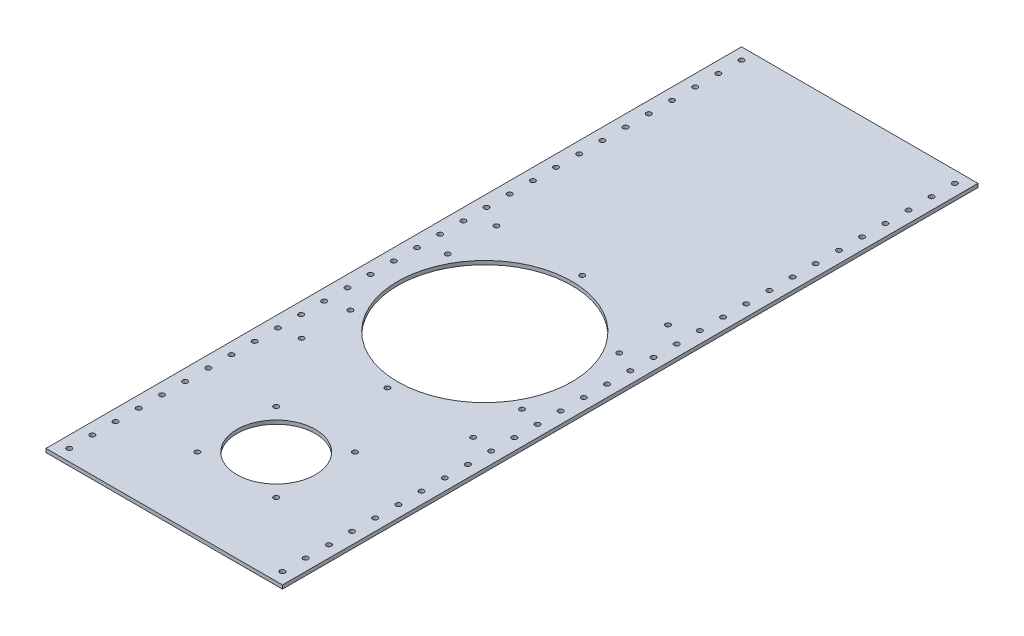
from build123d import *

# Parameters (mm, degrees)
SKETCH1_W           = 204
SKETCH1_H           = 600
SKETCH1_R           = 2.15
SKETCH1_R_2         = 2.125
SKETCH1_R_3         = 33.85
SKETCH1_R_4         = 75.125
BOSS_EXTRUDE1_DEPTH = 3.175


with BuildPart() as part:
    # Sketch1 → Boss-Extrude1 (new body)
    with BuildSketch(Plane(origin=(0, 0, 0), x_dir=(1, 0, 0), z_dir=(0, 1, 0))):
        with Locations((0, -50)):
            Rectangle(SKETCH1_W, SKETCH1_H)
        with Locations(Location((92, 240, 0), (0, 0, 270))):
            Circle(SKETCH1_R, mode=Mode.SUBTRACT)
        with Locations(Location((92, 220, 0), (0, 0, 270))):
            Circle(SKETCH1_R, mode=Mode.SUBTRACT)
        with Locations(Location((92, 200, 0), (0, 0, 270))):
            Circle(SKETCH1_R, mode=Mode.SUBTRACT)
        with Locations(Location((92, 180, 0), (0, 0, 270))):
            Circle(SKETCH1_R, mode=Mode.SUBTRACT)
        with Locations(Location((92, 160, 0), (0, 0, 270))):
            Circle(SKETCH1_R, mode=Mode.SUBTRACT)
        with Locations(Location((92, 140, 0), (0, 0, 270))):
            Circle(SKETCH1_R, mode=Mode.SUBTRACT)
        with Locations(Location((92, 120, 0), (0, 0, 270))):
            Circle(SKETCH1_R, mode=Mode.SUBTRACT)
        with Locations(Location((92, 100, 0), (0, 0, 270))):
            Circle(SKETCH1_R, mode=Mode.SUBTRACT)
        with Locations(Location((92, 80, 0), (0, 0, 270))):
            Circle(SKETCH1_R, mode=Mode.SUBTRACT)
        with Locations(Location((92, 60, 0), (0, 0, 270))):
            Circle(SKETCH1_R, mode=Mode.SUBTRACT)
        with Locations(Location((92, 40, 0), (0, 0, 270))):
            Circle(SKETCH1_R, mode=Mode.SUBTRACT)
        with Locations(Location((92, 20, 0), (0, 0, 270))):
            Circle(SKETCH1_R, mode=Mode.SUBTRACT)
        with Locations(Location((92, 0, 0), (0, 0, 270))):
            Circle(SKETCH1_R, mode=Mode.SUBTRACT)
        with Locations(Location((92, -20, 0), (0, 0, 270))):
            Circle(SKETCH1_R, mode=Mode.SUBTRACT)
        with Locations(Location((92, -40, 0), (0, 0, 270))):
            Circle(SKETCH1_R, mode=Mode.SUBTRACT)
        with Locations(Location((92, -60, 0), (0, 0, 270))):
            Circle(SKETCH1_R, mode=Mode.SUBTRACT)
        with Locations(Location((92, -80, 0), (0, 0, 270))):
            Circle(SKETCH1_R, mode=Mode.SUBTRACT)
        with Locations(Location((92, -100, 0), (0, 0, 270))):
            Circle(SKETCH1_R, mode=Mode.SUBTRACT)
        with Locations(Location((92, -120, 0), (0, 0, 270))):
            Circle(SKETCH1_R, mode=Mode.SUBTRACT)
        with Locations(Location((92, -140, 0), (0, 0, 270))):
            Circle(SKETCH1_R, mode=Mode.SUBTRACT)
        with Locations(Location((92, -160, 0), (0, 0, 270))):
            Circle(SKETCH1_R, mode=Mode.SUBTRACT)
        with Locations(Location((92, -180, 0), (0, 0, 270))):
            Circle(SKETCH1_R, mode=Mode.SUBTRACT)
        with Locations(Location((92, -200, 0), (0, 0, 270))):
            Circle(SKETCH1_R, mode=Mode.SUBTRACT)
        with Locations(Location((92, -220, 0), (0, 0, 270))):
            Circle(SKETCH1_R, mode=Mode.SUBTRACT)
        with Locations(Location((92, -240, 0), (0, 0, 270))):
            Circle(SKETCH1_R, mode=Mode.SUBTRACT)
        with Locations(Location((92, -260, 0), (0, 0, 270))):
            Circle(SKETCH1_R, mode=Mode.SUBTRACT)
        with Locations(Location((92, -280, 0), (0, 0, 270))):
            Circle(SKETCH1_R, mode=Mode.SUBTRACT)
        with Locations(Location((92, -300, 0), (0, 0, 270))):
            Circle(SKETCH1_R, mode=Mode.SUBTRACT)
        with Locations(Location((92, -320, 0), (0, 0, 270))):
            Circle(SKETCH1_R, mode=Mode.SUBTRACT)
        with Locations(Location((92, -340, 0), (0, 0, 270))):
            Circle(SKETCH1_R, mode=Mode.SUBTRACT)
        with Locations(Location((-92, -340, 0), (0, 0, 90))):
            Circle(SKETCH1_R, mode=Mode.SUBTRACT)
        with Locations(Location((-92, -320, 0), (0, 0, 90))):
            Circle(SKETCH1_R, mode=Mode.SUBTRACT)
        with Locations(Location((-92, -300, 0), (0, 0, 90))):
            Circle(SKETCH1_R, mode=Mode.SUBTRACT)
        with Locations(Location((-92, -280, 0), (0, 0, 90))):
            Circle(SKETCH1_R, mode=Mode.SUBTRACT)
        with Locations(Location((-92, -260, 0), (0, 0, 90))):
            Circle(SKETCH1_R, mode=Mode.SUBTRACT)
        with Locations(Location((-92, -240, 0), (0, 0, 90))):
            Circle(SKETCH1_R, mode=Mode.SUBTRACT)
        with Locations(Location((-92, -220, 0), (0, 0, 90))):
            Circle(SKETCH1_R, mode=Mode.SUBTRACT)
        with Locations(Location((-92, -200, 0), (0, 0, 90))):
            Circle(SKETCH1_R, mode=Mode.SUBTRACT)
        with Locations(Location((-92, -180, 0), (0, 0, 90))):
            Circle(SKETCH1_R, mode=Mode.SUBTRACT)
        with Locations(Location((-92, -160, 0), (0, 0, 90))):
            Circle(SKETCH1_R, mode=Mode.SUBTRACT)
        with Locations(Location((-92, -140, 0), (0, 0, 90))):
            Circle(SKETCH1_R, mode=Mode.SUBTRACT)
        with Locations(Location((-92, -120, 0), (0, 0, 90))):
            Circle(SKETCH1_R, mode=Mode.SUBTRACT)
        with Locations(Location((-92, -100, 0), (0, 0, 90))):
            Circle(SKETCH1_R, mode=Mode.SUBTRACT)
        with Locations(Location((-92, -80, 0), (0, 0, 90))):
            Circle(SKETCH1_R, mode=Mode.SUBTRACT)
        with Locations(Location((-92, -60, 0), (0, 0, 90))):
            Circle(SKETCH1_R, mode=Mode.SUBTRACT)
        with Locations(Location((-92, -40, 0), (0, 0, 90))):
            Circle(SKETCH1_R, mode=Mode.SUBTRACT)
        with Locations(Location((-92, -20, 0), (0, 0, 90))):
            Circle(SKETCH1_R, mode=Mode.SUBTRACT)
        with Locations(Location((-92, 0, 0), (0, 0, 90))):
            Circle(SKETCH1_R, mode=Mode.SUBTRACT)
        with Locations(Location((-92, 20, 0), (0, 0, 90))):
            Circle(SKETCH1_R, mode=Mode.SUBTRACT)
        with Locations(Location((-92, 40, 0), (0, 0, 90))):
            Circle(SKETCH1_R, mode=Mode.SUBTRACT)
        with Locations(Location((-92, 60, 0), (0, 0, 90))):
            Circle(SKETCH1_R, mode=Mode.SUBTRACT)
        with Locations(Location((-92, 80, 0), (0, 0, 90))):
            Circle(SKETCH1_R, mode=Mode.SUBTRACT)
        with Locations(Location((-92, 100, 0), (0, 0, 90))):
            Circle(SKETCH1_R, mode=Mode.SUBTRACT)
        with Locations(Location((-92, 120, 0), (0, 0, 90))):
            Circle(SKETCH1_R, mode=Mode.SUBTRACT)
        with Locations(Location((-92, 140, 0), (0, 0, 90))):
            Circle(SKETCH1_R, mode=Mode.SUBTRACT)
        with Locations(Location((-92, 160, 0), (0, 0, 90))):
            Circle(SKETCH1_R, mode=Mode.SUBTRACT)
        with Locations(Location((-92, 180, 0), (0, 0, 90))):
            Circle(SKETCH1_R, mode=Mode.SUBTRACT)
        with Locations(Location((-92, 200, 0), (0, 0, 90))):
            Circle(SKETCH1_R, mode=Mode.SUBTRACT)
        with Locations(Location((-92, 220, 0), (0, 0, 90))):
            Circle(SKETCH1_R, mode=Mode.SUBTRACT)
        with Locations(Location((-92, 240, 0), (0, 0, 90))):
            Circle(SKETCH1_R, mode=Mode.SUBTRACT)
        with Locations(Location((-74, -157.451, 0), (0, 0, 270))):
            Circle(SKETCH1_R_2, mode=Mode.SUBTRACT)
        with Locations(Location((-74, -115.451, 0), (0, 0, 270))):
            Circle(SKETCH1_R_2, mode=Mode.SUBTRACT)
        with Locations(Location((0, -157.451, 0), (0, 0, 270))):
            Circle(SKETCH1_R_2, mode=Mode.SUBTRACT)
        with Locations(Location((74, -157.451, 0), (0, 0, 90))):
            Circle(SKETCH1_R_2, mode=Mode.SUBTRACT)
        with Locations(Location((74, -115.451, 0), (0, 0, 90))):
            Circle(SKETCH1_R_2, mode=Mode.SUBTRACT)
        with Locations(Location((74, -31.451, 0), (0, 0, 270))):
            Circle(SKETCH1_R_2, mode=Mode.SUBTRACT)
        with Locations(Location((74, 10.549, 0), (0, 0, 270))):
            Circle(SKETCH1_R_2, mode=Mode.SUBTRACT)
        with Locations(Location((0, 10.549, 0), (0, 0, 90))):
            Circle(SKETCH1_R_2, mode=Mode.SUBTRACT)
        with Locations(Location((-74, 10.549, 0), (0, 0, 90))):
            Circle(SKETCH1_R_2, mode=Mode.SUBTRACT)
        with Locations(Location((-74, -31.451, 0), (0, 0, 90))):
            Circle(SKETCH1_R_2, mode=Mode.SUBTRACT)
        with Locations(Location((0, -253.451, 0), (0, 0, 270))):
            Circle(SKETCH1_R_3, mode=Mode.SUBTRACT)
        with Locations(Location((0, -73.451, 0), (0, 0, 270))):
            Circle(SKETCH1_R_4, mode=Mode.SUBTRACT)
        with Locations(Location((-34, -287.451, 0), (0, 0, 270))):
            Circle(SKETCH1_R, mode=Mode.SUBTRACT)
        with Locations(Location((34, -287.451, 0), (0, 0, 90))):
            Circle(SKETCH1_R, mode=Mode.SUBTRACT)
        with Locations(Location((34, -219.451, 0), (0, 0, 270))):
            Circle(SKETCH1_R, mode=Mode.SUBTRACT)
        with Locations(Location((-34, -219.451, 0), (0, 0, 90))):
            Circle(SKETCH1_R, mode=Mode.SUBTRACT)
    extrude(amount=BOSS_EXTRUDE1_DEPTH)


solid = part.part
